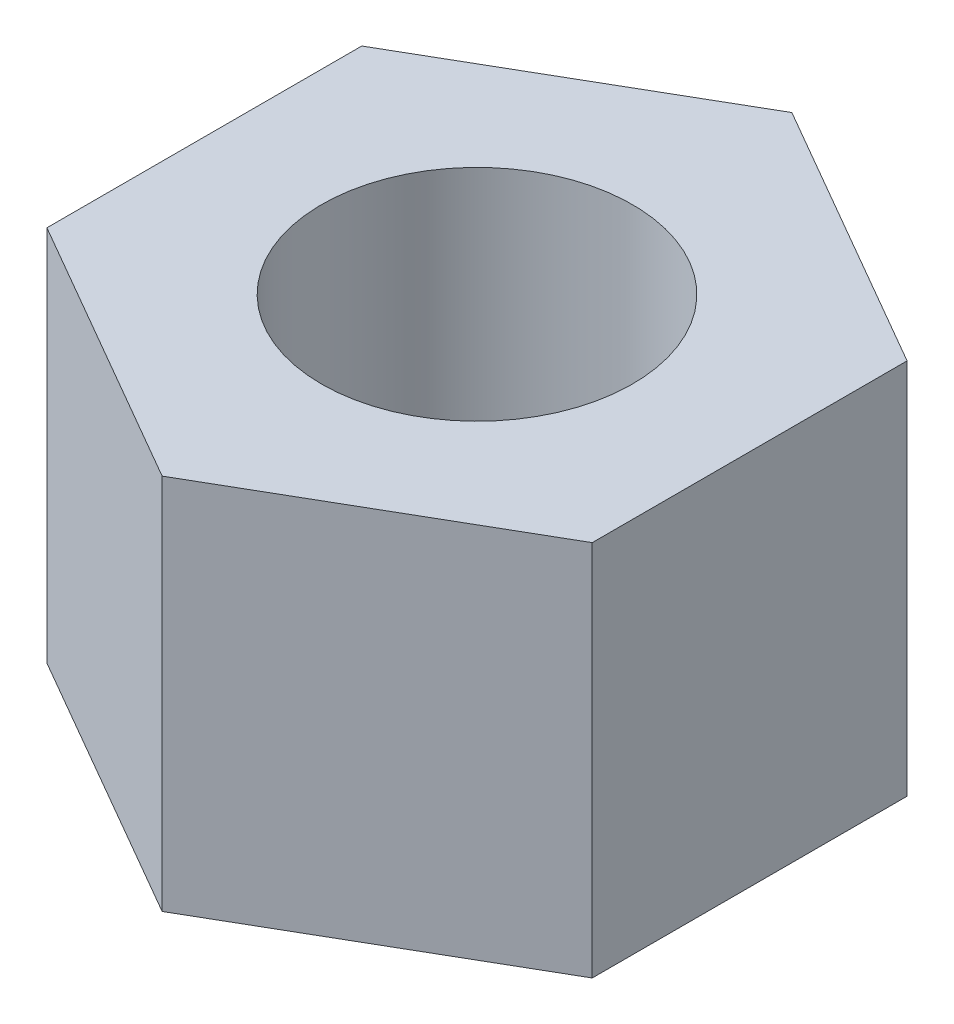
from build123d import *

# Parameters (mm, degrees)
SKETCH_1_R      = 2
EXTRUDE_1_DEPTH = 4.85


with BuildPart() as part:
    # ｽｹｯﾁ1 → ﾎﾞｽ - 押し出し1 (new body)
    with BuildSketch(Plane(origin=(0, 0, 0), x_dir=(1, 0, 0), z_dir=(0, 1, 0))):
        Polygon((3.507402885, 2.025), (0, 4.05), (-3.507402885, 2.025), (-3.507402885, -2.025), (0, -4.05), (3.507402885, -2.025), align=None)
        with Locations(Location((0, 0, 0), (0, 0, 270))):
            Circle(SKETCH_1_R, mode=Mode.SUBTRACT)
    extrude(amount=EXTRUDE_1_DEPTH)


solid = part.part
